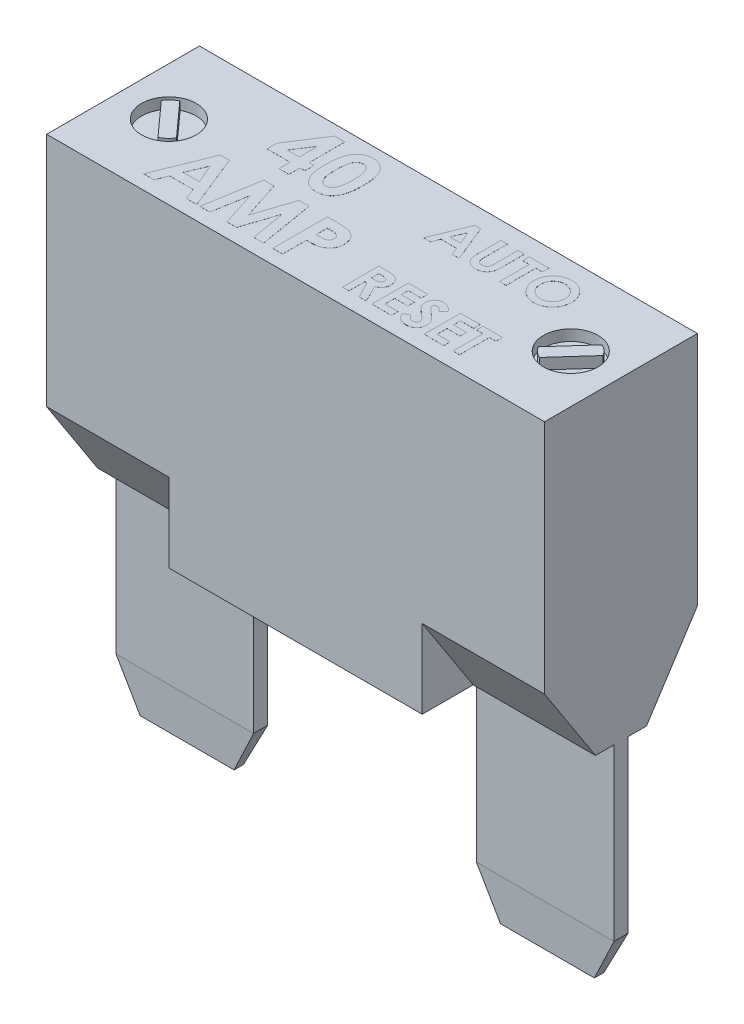
from build123d import *
from OCP.BRepFilletAPI import BRepFilletAPI_MakeChamfer

# Parameters (mm, degrees)
EXTRUDE1_DEPTH            = 14.478
SKETCH2_W                 = 8.89
SKETCH2_H                 = 18.288
EXTRUDE2_DEPTH            = 7.366
SKETCH3_W                 = 8.001
SKETCH3_H                 = 0.8128
EXTRUDE3_DEPTH            = 12.446
CHAMFER1_SIZE             = 2.54
CHAMFER1_SIZE2            = 0.133115759
CHAMFER2_SIZE             = 2.54
CHAMFER2_SIZE2            = 1.270274247
SKETCH4_R                 = 1.5875
EXTRUDE4_DEPTH            = 0.635
EXTRUDE5_DEPTH            = 0.635
CHAMFER1_OF_MIRROR1_SIZE  = 2.54
CHAMFER1_OF_MIRROR1_SIZE2 = 0.133115759
CHAMFER2_OF_MIRROR1_SIZE  = 2.54
CHAMFER2_OF_MIRROR1_SIZE2 = 1.270274247
EXTRUDE6_DEPTH            = 0.00254


with BuildPart() as part:
    # Sketch1 → Extrude1 (new, symmetric)
    with BuildSketch(Plane(origin=(0, 0, 0), x_dir=(0, 0, -1), z_dir=(1, 0, 0))):
        Polygon((-4.445, 4.572), (-1.481577724, 0), (1.481577724, 0), (4.445, 4.572), (4.445, 18.288), (-4.445, 18.288), align=None)
    extrude(amount=EXTRUDE1_DEPTH, both=True)

    # Sketch2 → Extrude2 (add, symmetric)
    with BuildSketch(Plane(origin=(0, 0, 0), x_dir=(0, 0, -1), z_dir=(1, 0, 0))):
        with Locations((0, 9.144)):
            Rectangle(SKETCH2_W, SKETCH2_H)
    extrude(amount=EXTRUDE2_DEPTH, both=True)

    # Sketch3 → Extrude3 (add)
    with BuildSketch(Plane.XZ):
        with Locations((-10.4775, 0)):
            Rectangle(SKETCH3_W, SKETCH3_H)
    extrude3 = extrude(amount=EXTRUDE3_DEPTH)

    # Chamfer1: one chamfer whose edges measure the first distance from different faces: ONE call of the kernel's chamfer builder (chamfer() names one face for all edges)
    chamfer1_edges_1 = [part.edges().sort_by_distance(p)[0] for p in [
        (-10.4775, -12.446, -0.4064),
    ]]
    chamfer1_side_1 = [part.faces().sort_by_distance(p)[0] for p in [
        (-10.4775, -6.223, -0.4064),
    ]]
    chamfer1_edges_2 = [part.edges().sort_by_distance(p)[0] for p in [
        (-10.4775, -12.446, 0.4064),
    ]]
    chamfer1_side_2 = [part.faces().sort_by_distance(p)[0] for p in [
        (-10.4775, -6.223, 0.4064),
    ]]
    chamfer1 = BRepFilletAPI_MakeChamfer(part.part.solid().wrapped)
    for e in chamfer1_edges_1:
        chamfer1.Add(CHAMFER1_SIZE, CHAMFER1_SIZE2, e.wrapped, chamfer1_side_1[0].wrapped)  # the first distance lies on this face
    for e in chamfer1_edges_2:
        chamfer1.Add(CHAMFER1_SIZE, CHAMFER1_SIZE2, e.wrapped, chamfer1_side_2[0].wrapped)  # the first distance lies on this face
    add(Compound.cast(chamfer1.Shape()), mode=Mode.REPLACE)

    # Chamfer2: one chamfer whose edges measure the first distance from different faces: ONE call of the kernel's chamfer builder (chamfer() names one face for all edges)
    chamfer2_edges_1 = [part.edges().sort_by_distance(p)[0] for p in [
        (-14.478, -12.446, 0),
    ]]
    chamfer2_side_1 = [part.faces().sort_by_distance(p)[0] for p in [
        (-14.478, 8.85938846, 0),
    ]]
    chamfer2_edges_2 = [part.edges().sort_by_distance(p)[0] for p in [
        (-6.477, -12.446, 0),
    ]]
    chamfer2_side_2 = [part.faces().sort_by_distance(p)[0] for p in [
        (-6.477, -6.037091359, 0),
    ]]
    chamfer2 = BRepFilletAPI_MakeChamfer(part.part.solid().wrapped)
    for e in chamfer2_edges_1:
        chamfer2.Add(CHAMFER2_SIZE, CHAMFER2_SIZE2, e.wrapped, chamfer2_side_1[0].wrapped)  # the first distance lies on this face
    for e in chamfer2_edges_2:
        chamfer2.Add(CHAMFER2_SIZE, CHAMFER2_SIZE2, e.wrapped, chamfer2_side_2[0].wrapped)  # the first distance lies on this face
    add(Compound.cast(chamfer2.Shape()), mode=Mode.REPLACE)

    # Sketch4 → Extrude4 (cut)
    with BuildSketch(Plane(origin=(0, 18.288, 0), x_dir=(1, 0, 0), z_dir=(0, 1, 0))):
        with Locations(Location((-11.684, -0.127, 0), (0, 0, 270))):
            Circle(SKETCH4_R)
        with Locations(Location((11.684, -0.127, 0), (0, 0, 90))):
            Circle(SKETCH4_R)
    extrude(amount=-EXTRUDE4_DEPTH, mode=Mode.SUBTRACT)

    # Sketch5 → Extrude5 (add)
    with BuildSketch(Plane(origin=(0, 17.653, 0), x_dir=(1, 0, 0), z_dir=(0, 1, 0))):
        with BuildLine():
            Line((-10.520386715, -0.849927911), (-12.281336928, 1.105805433))
            ThreePointArc((-12.281336928, 1.105805433), (-12.600640707, 0.89103264), (-12.847613285, 0.595927911))
            Line((-12.847613285, 0.595927911), (-11.086663072, -1.359805433))
            ThreePointArc((-11.086663072, -1.359805433), (-10.767359293, -1.14503264), (-10.520386715, -0.849927911))
        make_face()
    extrude5 = extrude(amount=EXTRUDE5_DEPTH)

    # Mirror1: Extrude3, Extrude5 across plane
    add(extrude3.mirror(Plane(origin=(0, 0, 0), x_dir=(0, 0, 1), z_dir=(1, 0, 0))))
    add(extrude5.mirror(Plane(origin=(0, 0, 0), x_dir=(0, 0, 1), z_dir=(1, 0, 0))))

    # Chamfer1 of Mirror1: one chamfer whose edges measure the first distance from different faces: ONE call of the kernel's chamfer builder (chamfer() names one face for all edges)
    chamfer1_of_mirror1_edges_1 = [part.edges().sort_by_distance(p)[0] for p in [
        (10.4775, -12.446, -0.4064),
    ]]
    chamfer1_of_mirror1_side_1 = [part.faces().sort_by_distance(p)[0] for p in [
        (10.4775, -6.223, -0.4064),
    ]]
    chamfer1_of_mirror1_edges_2 = [part.edges().sort_by_distance(p)[0] for p in [
        (10.4775, -12.446, 0.4064),
    ]]
    chamfer1_of_mirror1_side_2 = [part.faces().sort_by_distance(p)[0] for p in [
        (10.4775, -6.223, 0.4064),
    ]]
    chamfer1_of_mirror1 = BRepFilletAPI_MakeChamfer(part.part.solid().wrapped)
    for e in chamfer1_of_mirror1_edges_1:
        chamfer1_of_mirror1.Add(CHAMFER1_OF_MIRROR1_SIZE, CHAMFER1_OF_MIRROR1_SIZE2, e.wrapped, chamfer1_of_mirror1_side_1[0].wrapped)  # the first distance lies on this face
    for e in chamfer1_of_mirror1_edges_2:
        chamfer1_of_mirror1.Add(CHAMFER1_OF_MIRROR1_SIZE, CHAMFER1_OF_MIRROR1_SIZE2, e.wrapped, chamfer1_of_mirror1_side_2[0].wrapped)  # the first distance lies on this face
    add(Compound.cast(chamfer1_of_mirror1.Shape()), mode=Mode.REPLACE)

    # Chamfer2 of Mirror1: one chamfer whose edges measure the first distance from different faces: ONE call of the kernel's chamfer builder (chamfer() names one face for all edges)
    chamfer2_of_mirror1_edges_1 = [part.edges().sort_by_distance(p)[0] for p in [
        (14.478, -12.446, 0),
    ]]
    chamfer2_of_mirror1_side_1 = [part.faces().sort_by_distance(p)[0] for p in [
        (14.478, 8.85938846, 0),
    ]]
    chamfer2_of_mirror1_edges_2 = [part.edges().sort_by_distance(p)[0] for p in [
        (6.477, -12.446, 0),
    ]]
    chamfer2_of_mirror1_side_2 = [part.faces().sort_by_distance(p)[0] for p in [
        (6.477, -6.037091359, 0),
    ]]
    chamfer2_of_mirror1 = BRepFilletAPI_MakeChamfer(part.part.solid().wrapped)
    for e in chamfer2_of_mirror1_edges_1:
        chamfer2_of_mirror1.Add(CHAMFER2_OF_MIRROR1_SIZE, CHAMFER2_OF_MIRROR1_SIZE2, e.wrapped, chamfer2_of_mirror1_side_1[0].wrapped)  # the first distance lies on this face
    for e in chamfer2_of_mirror1_edges_2:
        chamfer2_of_mirror1.Add(CHAMFER2_OF_MIRROR1_SIZE, CHAMFER2_OF_MIRROR1_SIZE2, e.wrapped, chamfer2_of_mirror1_side_2[0].wrapped)  # the first distance lies on this face
    add(Compound.cast(chamfer2_of_mirror1.Shape()), mode=Mode.REPLACE)

    # Sketch7 → Extrude6 (add)
    # profile 1 of 14: a face of its own
    with BuildSketch(Plane(origin=(0, 18.288, 0), x_dir=(1, 0, 0), z_dir=(0, 1, 0))):
        Polygon((-6.008239342, 3.833529575), (-5.414198877, 3.833529575), (-5.414198877, 1.757568037), (-5.129262979, 1.757568037), (-5.129262979, 1.22840137), (-5.414198877, 1.22840137), (-5.414198877, 0.577119319), (-5.984070672, 0.577119319), (-5.984070672, 1.22840137), (-7.327339903, 1.22840137), (-7.327339903, 1.805269359), align=None)
        Polygon((-5.984070672, 1.757568037), (-5.984070672, 2.838161987), (-6.686870151, 1.757568037), align=None, mode=Mode.SUBTRACT)
    # profile 2 of 14: a face of its own
    with BuildSketch(Plane(origin=(0, 18.288, 0), x_dir=(1, 0, 0), z_dir=(0, 1, 0))):
        with BuildLine():
            add(Edge.make_bspline(
                [(-3.775181449, 3.833529575), (-3.747597289, 3.833120081), (-3.69335946, 3.832314905), (-3.613477348, 3.823594194), (-3.536528788, 3.810419633), (-3.462212747, 3.792045714), (-3.391064161, 3.767728487), (-3.322565195, 3.738621183), (-3.257531185, 3.703197064), (-3.19513274, 3.663183703), (-3.135393895, 3.617882905), (-3.079750432, 3.566237656), (-3.027186183, 3.509436316), (-2.97883897, 3.44662015), (-2.933638131, 3.378360538), (-2.891732186, 3.304646657), (-2.853441936, 3.225117725), (-2.81833824, 3.139630227), (-2.786948404, 3.046902742), (-2.760508784, 2.945871645), (-2.737832386, 2.836513865), (-2.718691906, 2.718557193), (-2.704224796, 2.591844837), (-2.694473673, 2.456460977), (-2.687781991, 2.312666615), (-2.687235863, 2.214024865), (-2.686955287, 2.163347284)],
                knots=[0, 0, 0, 0, 0.879237366, 1.728815576, 2.559023295, 3.367336655, 4.166867292, 4.954216142, 5.737608147, 6.525189134, 7.316157332, 8.124696809, 8.942788509, 9.781158001, 10.649253743, 11.551476218, 12.482711956, 13.461909668, 14.496590415, 15.601789533, 16.789733467, 18.056700938, 19.410929216, 20.8549011, 22.384193279, 24, 24, 24, 24], degree=3))
            add(Edge.make_bspline(
                [(-2.686955287, 2.163347284), (-2.687258514, 2.112035669), (-2.687847677, 2.012338123), (-2.694195498, 1.867228544), (-2.705126746, 1.730861717), (-2.719215727, 1.603251749), (-2.738513778, 1.484466028), (-2.761114477, 1.374196981), (-2.787971439, 1.272484576), (-2.820395246, 1.179557993), (-2.855286458, 1.09392036), (-2.893681448, 1.01454649), (-2.934910995, 0.941221396), (-2.978029419, 0.872838869), (-3.025400628, 0.811414789), (-3.074718935, 0.754860419), (-3.128131744, 0.705329986), (-3.183390172, 0.660270913), (-3.242518556, 0.621330833), (-3.304907123, 0.58727448), (-3.371668151, 0.559650733), (-3.4415847, 0.535625073), (-3.515848514, 0.518377242), (-3.593279548, 0.504691655), (-3.674751986, 0.49712816), (-3.730221702, 0.496189858), (-3.758644991, 0.495709062)],
                knots=[0, 0, 0, 0, 1.643780988, 3.193836972, 4.651895693, 6.025988579, 7.305620092, 8.505800249, 9.631074763, 10.672816429, 11.65661981, 12.592235626, 13.49536222, 14.350718032, 15.179365177, 15.97804903, 16.751647189, 17.51006938, 18.259804725, 19.016521909, 19.783502495, 20.571750527, 21.382245291, 22.22305063, 23.089471752, 24, 24, 24, 24], degree=3))
            add(Edge.make_bspline(
                [(-3.758644991, 0.495709062), (-3.787067512, 0.496199133), (-3.842746812, 0.497159173), (-3.924439559, 0.504635417), (-4.00228094, 0.518432682), (-4.077132299, 0.535757489), (-4.148472683, 0.559597574), (-4.216644168, 0.588047803), (-4.281122573, 0.621891661), (-4.34208643, 0.660922469), (-4.399327589, 0.705680062), (-4.453735579, 0.755685708), (-4.505190045, 0.810812655), (-4.552908238, 0.87167837), (-4.597671644, 0.937470424), (-4.639013451, 1.008940129), (-4.676908813, 1.085983428), (-4.712543106, 1.168707711), (-4.743504795, 1.258893936), (-4.771059261, 1.357347456), (-4.793631155, 1.464888961), (-4.811784982, 1.581483903), (-4.826278988, 1.70688527), (-4.837060862, 1.84115359), (-4.843443942, 1.984351402), (-4.844026927, 2.082778391), (-4.844327082, 2.133454455)],
                knots=[0, 0, 0, 0, 0.917216111, 1.796812873, 2.643793957, 3.46689424, 4.273913431, 5.068098542, 5.848489301, 6.620921603, 7.401012384, 8.190319798, 9.003608147, 9.831726257, 10.68377682, 11.569763213, 12.493818149, 13.453288342, 14.474581811, 15.568529029, 16.750744269, 18.018426408, 19.375425659, 20.823733699, 22.36466933, 24, 24, 24, 24], degree=3))
            add(Edge.make_bspline(
                [(-4.844327082, 2.133454455), (-4.843783379, 2.203864856), (-4.842734297, 2.339722633), (-4.829439555, 2.535997619), (-4.809926247, 2.717419844), (-4.781265819, 2.883685834), (-4.745827597, 3.035411388), (-4.700447108, 3.171597018), (-4.648784722, 3.294127158), (-4.604761733, 3.366714751), (-4.583559854, 3.401673606)],
                knots=[0, 0, 0, 0, 1.288568992, 2.486310467, 3.599230591, 4.627010532, 5.572937695, 6.447898582, 7.252493626, 8, 8, 8, 8], degree=3))
            add(Edge.make_bspline(
                [(-4.583559854, 3.401673606), (-4.55890732, 3.436017174), (-4.510706758, 3.503165617), (-4.426426728, 3.591318971), (-4.335878809, 3.666712036), (-4.237203198, 3.727638599), (-4.131960491, 3.775685292), (-4.019247126, 3.80962013), (-3.899479335, 3.829392148), (-3.817232794, 3.832129838), (-3.775181449, 3.833529575)],
                knots=[0, 0, 0, 0, 1.058512271, 2.069600068, 3.047294572, 4.004278952, 4.967380941, 5.939006123, 6.946246673, 8, 8, 8, 8], degree=3))
        make_face()
        with BuildLine():
            add(Edge.make_bspline(
                [(-3.761189061, 3.26365778), (-3.786125371, 3.262475849), (-3.835013774, 3.260158636), (-3.905953177, 3.240488766), (-3.972844605, 3.21010759), (-4.023727127, 3.173548596), (-4.061812189, 3.138502416), (-4.088422495, 3.106786763), (-4.114083941, 3.07139438), (-4.136749423, 3.03072819), (-4.158151554, 2.986249378), (-4.179067887, 2.937756038), (-4.196213788, 2.884057066), (-4.21305918, 2.826066965), (-4.227817317, 2.762182461), (-4.240181399, 2.691881369), (-4.25122762, 2.614706515), (-4.258932491, 2.530607349), (-4.266115743, 2.43967186), (-4.271265038, 2.341697479), (-4.273417829, 2.236710636), (-4.274102136, 2.164407756), (-4.274455287, 2.127094279)],
                knots=[0, 0, 0, 0, 1.076674018, 2.110852608, 3.161083442, 4.239746716, 4.804137807, 5.395870207, 6.026861976, 6.692161227, 7.405688833, 8.16177676, 8.973626916, 9.841385931, 10.773283133, 11.807421078, 12.927755683, 14.143907515, 15.458935494, 16.872852025, 18.386167141, 20, 20, 20, 20], degree=3))
            add(Edge.make_bspline(
                [(-4.274455287, 2.127094279), (-4.273874043, 2.078752865), (-4.272759464, 1.986054621), (-4.266921819, 1.852751318), (-4.255220744, 1.731434579), (-4.240666969, 1.621282194), (-4.220225599, 1.523008532), (-4.196706478, 1.435683833), (-4.167662456, 1.360421274), (-4.134096492, 1.296132389), (-4.096920675, 1.241441969), (-4.05656469, 1.194954865), (-4.014402514, 1.154699227), (-3.969118128, 1.122000068), (-3.920819567, 1.09694094), (-3.869910036, 1.078916218), (-3.816357182, 1.067882536), (-3.77968474, 1.066352519), (-3.761189061, 1.065580857)],
                knots=[0, 0, 0, 0, 1.771748488, 3.397459088, 4.888034009, 6.237357457, 7.467047327, 8.564189669, 9.548206622, 10.417051504, 11.216568818, 11.965764335, 12.669334354, 13.348544111, 14.005342236, 14.656555988, 15.322436492, 16, 16, 16, 16], degree=3))
            add(Edge.make_bspline(
                [(-3.761189061, 1.065580857), (-3.743328096, 1.066108885), (-3.708358546, 1.067142698), (-3.657365111, 1.077754651), (-3.609142095, 1.095007382), (-3.563835099, 1.11941258), (-3.521282066, 1.150447524), (-3.481690969, 1.188248594), (-3.445360397, 1.233192579), (-3.42419404, 1.266547663), (-3.413287419, 1.283734904)],
                knots=[0, 0, 0, 0, 0.992283464, 1.942767638, 2.88273346, 3.832339453, 4.79467288, 5.803907806, 6.868395428, 8, 8, 8, 8], degree=3))
            add(Edge.make_bspline(
                [(-3.413287419, 1.283734904), (-3.400446709, 1.307220719), (-3.373520782, 1.356468569), (-3.342362053, 1.439572479), (-3.316134371, 1.533299955), (-3.293560589, 1.637942685), (-3.278121499, 1.753913393), (-3.264825374, 1.880476699), (-3.258412322, 2.018269924), (-3.257369204, 2.113733567), (-3.256827082, 2.163347284)],
                knots=[0, 0, 0, 0, 0.710965849, 1.490837728, 2.352621235, 3.297892224, 4.334225155, 5.461620853, 6.680770821, 8, 8, 8, 8], degree=3))
            add(Edge.make_bspline(
                [(-3.256827082, 2.163347284), (-3.257036492, 2.213391671), (-3.257439571, 2.309718575), (-3.264834896, 2.448007176), (-3.275133451, 2.574310862), (-3.290197265, 2.688347648), (-3.309579599, 2.790394366), (-3.333468398, 2.880444345), (-3.361631516, 2.958675056), (-3.395029618, 3.025008491), (-3.43202009, 3.081382812), (-3.471286606, 3.129747606), (-3.5129952, 3.171040248), (-3.557076122, 3.205416127), (-3.604549639, 3.231681878), (-3.654508947, 3.25022767), (-3.707056465, 3.261447253), (-3.742901311, 3.262910992), (-3.761189061, 3.26365778)],
                knots=[0, 0, 0, 0, 1.793836731, 3.452829483, 4.963243077, 6.335886805, 7.574563692, 8.684454726, 9.672768357, 10.54971625, 11.340229787, 12.085688095, 12.778991901, 13.440269426, 14.083255152, 14.715733572, 15.344777694, 16, 16, 16, 16], degree=3))
        make_face(mode=Mode.SUBTRACT)
    # profile 3 of 14: a face of its own
    with BuildSketch(Plane(origin=(0, 18.288, 0), x_dir=(1, 0, 0), z_dir=(0, 1, 0))):
        Polygon((-8.381308192, -0.44156083), (-7.852777543, -0.44156083), (-6.570566004, -3.61656083), (-7.179234874, -3.61656083), (-7.426009714, -2.965278779), (-8.809348055, -2.965278779), (-9.056122895, -3.61656083), (-9.664155748, -3.61656083), align=None)
        Polygon((-8.117360876, -1.293188434), (-8.593102062, -2.395406984), (-7.64161969, -2.395406984), align=None, mode=Mode.SUBTRACT)
    # profile 4 of 14: a face of its own
    with BuildSketch(Plane(origin=(0, 18.288, 0), x_dir=(1, 0, 0), z_dir=(0, 1, 0))):
        Polygon((-5.851230067, -0.44156083), (-5.259733672, -0.44156083), (-4.535309594, -2.656174212), (-3.805797374, -0.44156083), (-3.220025139, -0.44156083), (-2.683226261, -3.61656083), (-3.260094249, -3.61656083), (-3.599091645, -1.611197248), (-4.259277943, -3.61656083), (-4.81515735, -3.61656083), (-5.471527543, -1.611197248), (-5.809888921, -3.61656083), (-6.387392927, -3.61656083), align=None)
    # profile 5 of 14: a face of its own
    with BuildSketch(Plane(origin=(0, 18.288, 0), x_dir=(1, 0, 0), z_dir=(0, 1, 0))):
        with BuildLine():
            Line((-2.154059594, -0.44156083), (-1.518041966, -0.44156083))
            add(Edge.make_bspline(
                [(-1.518041966, -0.44156083), (-1.476485399, -0.441746846), (-1.396314071, -0.44210571), (-1.28070042, -0.446457413), (-1.174041166, -0.454255929), (-1.076360814, -0.463893661), (-0.987699528, -0.477405387), (-0.907946277, -0.492895523), (-0.837084511, -0.511767016), (-0.774315157, -0.534167218), (-0.71798169, -0.56057618), (-0.664672061, -0.58870361), (-0.615591073, -0.622272705), (-0.568261461, -0.657665532), (-0.52538914, -0.698263153), (-0.484299479, -0.741363737), (-0.446732736, -0.788676619), (-0.412514841, -0.839629089), (-0.381473939, -0.893279762), (-0.354354529, -0.949724551), (-0.332356783, -1.009052774), (-0.313903409, -1.070880643), (-0.29908148, -1.135205465), (-0.289215531, -1.202422844), (-0.282514083, -1.27206344), (-0.281922773, -1.319460875), (-0.281623696, -1.343433827)],
                knots=[0, 0, 0, 0, 1.698747864, 3.27724071, 4.728299578, 6.070144658, 7.288476769, 8.393259625, 9.389771311, 10.283485332, 11.113357557, 11.931608583, 12.74405601, 13.541433047, 14.344816069, 15.154114104, 15.974336324, 16.810834471, 17.661136416, 18.50621059, 19.367396281, 20.244825668, 21.142564693, 22.063065223, 23.020325768, 24, 24, 24, 24], degree=3))
            add(Edge.make_bspline(
                [(-0.281623696, -1.343433827), (-0.282056423, -1.369954533), (-0.282906782, -1.42207098), (-0.29124305, -1.498467297), (-0.305484029, -1.571304269), (-0.324096243, -1.641196142), (-0.350049653, -1.706993041), (-0.379700204, -1.770264899), (-0.416179788, -1.829237769), (-0.457863543, -1.884649328), (-0.50338696, -1.936950101), (-0.553830762, -1.98463), (-0.608233468, -2.028014057), (-0.66628016, -2.067556943), (-0.728188764, -2.103178888), (-0.79391461, -2.135213456), (-0.863906509, -2.162636081), (-0.912646763, -2.176977892), (-0.937357871, -2.184249131)],
                knots=[0, 0, 0, 0, 1.102006807, 2.165578795, 3.188629044, 4.184801286, 5.166646146, 6.124351954, 7.085497154, 8.042432466, 9.003981491, 9.963833307, 10.922997304, 11.89326795, 12.880200226, 13.889073926, 14.929769137, 16, 16, 16, 16], degree=3))
            add(Edge.make_bspline(
                [(-0.937357871, -2.184249131), (-0.953634029, -2.188298666), (-0.988893427, -2.197071261), (-1.047238047, -2.205977647), (-1.114474096, -2.214166522), (-1.190818991, -2.221203868), (-1.276316748, -2.225987624), (-1.370884582, -2.229723524), (-1.47456535, -2.23243991), (-1.546660856, -2.232536299), (-1.584187799, -2.232586471)],
                knots=[0, 0, 0, 0, 0.618981996, 1.340914327, 2.176866532, 3.120127938, 4.170906482, 5.338178032, 6.614476169, 8, 8, 8, 8], degree=3))
            Line((-1.584187799, -2.232586471), (-1.584187799, -3.61656083))
            Line((-1.584187799, -3.61656083), (-2.154059594, -3.61656083))
            Line((-2.154059594, -3.61656083), (-2.154059594, -0.44156083))
        make_face()
        with BuildLine():
            Line((-1.584187799, -1.662714676), (-1.382570211, -1.662714676))
            add(Edge.make_bspline(
                [(-1.382570211, -1.662714676), (-1.345882708, -1.662482049), (-1.278377157, -1.662054012), (-1.186188412, -1.655864339), (-1.112103764, -1.646411459), (-1.053575516, -1.632853843), (-1.007361921, -1.612278366), (-0.967505588, -1.588476413), (-0.933319794, -1.558379497), (-0.903719928, -1.523988621), (-0.880055728, -1.484471781), (-0.863645837, -1.440472431), (-0.852986295, -1.392915046), (-0.852001787, -1.359818253), (-0.851495491, -1.342797809)],
                knots=[0, 0, 0, 0, 1.8619151, 3.425951444, 4.686033666, 5.651700536, 6.461346321, 7.243864085, 7.999046032, 8.762387399, 9.539336099, 10.322741239, 11.137448474, 12, 12, 12, 12], degree=3))
            add(Edge.make_bspline(
                [(-0.851495491, -1.342797809), (-0.851996579, -1.327927269), (-0.852968809, -1.299074846), (-0.860111079, -1.257433642), (-0.871493802, -1.21861545), (-0.88798693, -1.183025674), (-0.90930864, -1.150724787), (-0.935304119, -1.121725514), (-0.965639794, -1.09540681), (-0.989060708, -1.081475918), (-1.000959634, -1.07439837)],
                knots=[0, 0, 0, 0, 1.102301479, 2.1387299, 3.123554645, 4.094223062, 5.036071848, 5.982632524, 6.975082478, 8, 8, 8, 8], degree=3))
            add(Edge.make_bspline(
                [(-1.000959634, -1.07439837), (-1.011038711, -1.069301092), (-1.032378182, -1.058509109), (-1.068721371, -1.045962641), (-1.110660855, -1.035378312), (-1.158479775, -1.026593422), (-1.211987366, -1.019775434), (-1.271174082, -1.01456138), (-1.336127021, -1.012464605), (-1.381297904, -1.011786106), (-1.404830828, -1.011432625)],
                knots=[0, 0, 0, 0, 0.656809284, 1.390599849, 2.23162475, 3.173112763, 4.218524733, 5.370385145, 6.63003504, 8, 8, 8, 8], degree=3))
            Line((-1.404830828, -1.011432625), (-1.584187799, -1.011432625))
            Line((-1.584187799, -1.011432625), (-1.584187799, -1.662714676))
        make_face(mode=Mode.SUBTRACT)
    # profile 6 of 14: a face of its own
    with BuildSketch(Plane(origin=(0, 18.288, 0), x_dir=(1, 0, 0), z_dir=(0, 1, 0))):
        Polygon((2.557586423, 3.413395415), (2.909940189, 3.413395415), (3.764747882, 1.296728748), (3.358968635, 1.296728748), (3.194452075, 1.730916783), (2.272226514, 1.730916783), (2.107709954, 1.296728748), (1.702354719, 1.296728748), align=None)
        Polygon((2.733551301, 2.845643679), (2.41639051, 2.110831313), (3.050712091, 2.110831313), align=None, mode=Mode.SUBTRACT)
    # profile 7 of 14: a face of its own
    with BuildSketch(Plane(origin=(0, 18.288, 0), x_dir=(1, 0, 0), z_dir=(0, 1, 0))):
        with BuildLine():
            Line((4.076820531, 3.413395415), (4.456735061, 3.413395415))
            Line((4.456735061, 3.413395415), (4.456735061, 2.036205244))
            add(Edge.make_bspline(
                [(4.456735061, 2.036205244), (4.456755719, 2.021927134), (4.45679562, 1.994349111), (4.458793058, 1.954783678), (4.460620853, 1.91841476), (4.463918712, 1.885282175), (4.468790781, 1.855371749), (4.473508534, 1.828491349), (4.479893545, 1.805122236), (4.489489196, 1.778522068), (4.504272945, 1.748635327), (4.52842877, 1.717486679), (4.556302526, 1.689059017), (4.589710828, 1.665396908), (4.627258805, 1.646256395), (4.668740148, 1.632075393), (4.714096381, 1.624192639), (4.745457729, 1.622989192), (4.761599511, 1.622369774)],
                knots=[0, 0, 0, 0, 1.155499968, 2.231836252, 3.205919964, 4.102923608, 4.924856345, 5.658536265, 6.31071849, 6.882491295, 7.94666036, 8.992281882, 10.060072772, 11.158554251, 12.289267114, 13.461410017, 14.693379945, 16, 16, 16, 16], degree=3))
            add(Edge.make_bspline(
                [(4.761599511, 1.622369774), (4.778748162, 1.622870184), (4.812185129, 1.623845899), (4.860278883, 1.633423597), (4.904838018, 1.648674572), (4.944919066, 1.6704416), (4.980482141, 1.696533197), (5.010585538, 1.726285795), (5.034343028, 1.759758735), (5.049827277, 1.79064007), (5.05852092, 1.819063651), (5.065037238, 1.844459041), (5.069814421, 1.874423088), (5.074148437, 1.908487838), (5.076752848, 1.947006136), (5.079576906, 1.989668214), (5.080611949, 2.036765977), (5.080788365, 2.069561033), (5.08088036, 2.086662643)],
                knots=[0, 0, 0, 0, 1.261321664, 2.459363699, 3.594844139, 4.716940403, 5.803436589, 6.833651888, 7.818396249, 8.814403945, 9.360733334, 10.004355033, 10.743453831, 11.592799886, 12.532235708, 13.585170094, 14.740740724, 16, 16, 16, 16], degree=3))
            Line((5.08088036, 2.086662643), (5.08088036, 3.413395415))
            Line((5.08088036, 3.413395415), (5.46079489, 3.413395415))
            Line((5.46079489, 3.413395415), (5.46079489, 2.150688417))
            add(Edge.make_bspline(
                [(5.46079489, 2.150688417), (5.460742132, 2.125106034), (5.460640684, 2.075913605), (5.45908274, 2.005220624), (5.455766159, 1.940653925), (5.452980613, 1.882194643), (5.447589628, 1.829921531), (5.441973487, 1.783611369), (5.434815232, 1.743428269), (5.424164179, 1.697684693), (5.405783614, 1.64501264), (5.376151734, 1.584363055), (5.33853598, 1.524983437), (5.294076038, 1.467527004), (5.243876697, 1.414151829), (5.189050984, 1.367295334), (5.130469943, 1.327659792), (5.067521443, 1.296214339), (5.000259058, 1.271689257), (4.928017276, 1.255209637), (4.85084536, 1.244075799), (4.79754126, 1.243006257), (4.770079746, 1.242455244)],
                knots=[0, 0, 0, 0, 1.170808336, 2.251350247, 3.235597562, 4.129743112, 4.929140599, 5.639994148, 6.264258765, 6.79612947, 7.788252245, 8.809469599, 9.879094798, 10.999557536, 12.129761673, 13.226370002, 14.293821979, 15.358369427, 16.438775801, 17.562147481, 18.744053101, 20, 20, 20, 20], degree=3))
            add(Edge.make_bspline(
                [(4.770079746, 1.242455244), (4.75183377, 1.242762574), (4.715834834, 1.243368928), (4.662892083, 1.248715391), (4.611712514, 1.256594068), (4.562392293, 1.268088245), (4.51476024, 1.282936575), (4.468829008, 1.301213836), (4.424769289, 1.322818079), (4.382827636, 1.347550591), (4.34305566, 1.374294546), (4.306706128, 1.403941345), (4.272528165, 1.434298497), (4.24150916, 1.466643558), (4.213416132, 1.500636961), (4.188306938, 1.536355747), (4.166218882, 1.573796742), (4.146596353, 1.613634818), (4.129801382, 1.6578948), (4.115642591, 1.708151036), (4.103273138, 1.76519124), (4.09408089, 1.829143921), (4.085747145, 1.899798299), (4.080472343, 1.977338439), (4.077712857, 2.061766566), (4.077125489, 2.120298836), (4.076820531, 2.150688417)],
                knots=[0, 0, 0, 0, 1.001158378, 1.975264943, 2.917723546, 3.841610987, 4.75185031, 5.653588123, 6.552117133, 7.442167995, 8.324307438, 9.179605724, 10.014504199, 10.831958861, 11.636465792, 12.43274043, 13.225645099, 14.020104002, 14.867201867, 15.819789774, 16.883317127, 18.068162734, 19.364263498, 20.787406516, 22.332041935, 24, 24, 24, 24], degree=3))
            Line((4.076820531, 2.150688417), (4.076820531, 3.413395415))
        make_face()
    # profile 8 of 14: a face of its own
    with BuildSketch(Plane(origin=(0, 18.288, 0), x_dir=(1, 0, 0), z_dir=(0, 1, 0))):
        Polygon((5.732162412, 3.413395415), (6.871906001, 3.413395415), (6.871906001, 3.033480885), (6.491991472, 3.033480885), (6.491991472, 1.296728748), (6.112076942, 1.296728748), (6.112076942, 3.033480885), (5.732162412, 3.033480885), align=None)
    # profile 9 of 14: a face of its own
    with BuildSketch(Plane(origin=(0, 18.288, 0), x_dir=(1, 0, 0), z_dir=(0, 1, 0))):
        with BuildLine():
            add(Edge.make_bspline(
                [(8.165141845, 3.467668919), (8.20194269, 3.46671608), (8.274595891, 3.464834958), (8.381442533, 3.449154342), (8.484409028, 3.423605027), (8.583448815, 3.388089631), (8.67831391, 3.341646216), (8.769338935, 3.285591484), (8.856197841, 3.218867435), (8.938000568, 3.143030632), (9.013601042, 3.06056142), (9.079108896, 2.971768652), (9.134971591, 2.878953037), (9.181270743, 2.781865872), (9.216536164, 2.679834784), (9.241283369, 2.573379996), (9.257182222, 2.462531793), (9.259010834, 2.387059276), (9.259940189, 2.348701905)],
                knots=[0, 0, 0, 0, 1.014329547, 2.002516266, 2.970391464, 3.935626869, 4.897733899, 5.877609409, 6.878433252, 7.912639331, 8.949961323, 9.958554974, 10.949718813, 11.932905612, 12.9188844, 13.919928257, 14.942845884, 16, 16, 16, 16], degree=3))
            add(Edge.make_bspline(
                [(9.259940189, 2.348701905), (9.258950466, 2.310776734), (9.257000185, 2.236043967), (9.241932429, 2.126217274), (9.216768479, 2.020902838), (9.182101186, 1.919862279), (9.136641727, 1.823585), (9.081868415, 1.731456287), (9.016335888, 1.644331115), (8.942434373, 1.562256238), (8.86107522, 1.487755676), (8.77490296, 1.422102185), (8.684315485, 1.366469894), (8.589445386, 1.320884286), (8.490089218, 1.285506974), (8.386492403, 1.26054571), (8.278661352, 1.245376245), (8.205331008, 1.243438703), (8.168109928, 1.242455244)],
                knots=[0, 0, 0, 0, 1.051557043, 2.072126891, 3.067553643, 4.050577992, 5.02905126, 6.015227836, 7.017913613, 8.04756643, 9.074058332, 10.072836633, 11.047628519, 12.017157415, 12.98668631, 13.966869689, 14.968021931, 16, 16, 16, 16], degree=3))
            add(Edge.make_bspline(
                [(8.168109928, 1.242455244), (8.129181141, 1.243337456), (8.052691395, 1.245070881), (7.94074831, 1.26155496), (7.833497162, 1.286385742), (7.731838923, 1.323444352), (7.634738289, 1.369770731), (7.542908688, 1.426824444), (7.456380981, 1.494511205), (7.375651504, 1.571097532), (7.302510403, 1.654899771), (7.237949034, 1.743429406), (7.183490088, 1.836010147), (7.139131571, 1.932685324), (7.104161098, 2.032854125), (7.079493402, 2.137126606), (7.064921606, 2.245252684), (7.06289184, 2.318694078), (7.061863266, 2.355910105)],
                knots=[0, 0, 0, 0, 1.067978421, 2.098431617, 3.099715153, 4.085208694, 5.062210972, 6.048429807, 7.046490867, 8.072918869, 9.098532598, 10.095778865, 11.076610158, 12.041847152, 13.011192615, 13.984257998, 14.978533688, 16, 16, 16, 16], degree=3))
            add(Edge.make_bspline(
                [(7.061863266, 2.355910105), (7.062186092, 2.3809471), (7.062827655, 2.430704064), (7.070555962, 2.504441346), (7.081682501, 2.576739374), (7.098138124, 2.647309896), (7.1181275, 2.716650755), (7.144026561, 2.784116508), (7.173506701, 2.850427875), (7.207951469, 2.914801636), (7.246250721, 2.976645498), (7.288038614, 3.035667733), (7.333420225, 3.091154676), (7.382249363, 3.143470965), (7.4346943, 3.192272721), (7.490065178, 3.238250799), (7.549435869, 3.28018386), (7.611506935, 3.319095992), (7.675928434, 3.354283558), (7.742438112, 3.384234162), (7.809665737, 3.410389514), (7.87850938, 3.431032475), (7.94823126, 3.44784595), (8.019576213, 3.45896499), (8.091899679, 3.466693082), (8.14066985, 3.467342868), (8.165141845, 3.467668919)],
                knots=[0, 0, 0, 0, 1.034744296, 2.056386356, 3.06226378, 4.057406941, 5.050368692, 6.043467995, 7.042652155, 8.049140477, 9.059438543, 10.048523776, 11.036952808, 12.020949711, 13.004946614, 13.997082645, 14.994316842, 16.007702937, 17.024872941, 18.026463647, 19.021641123, 20.005082605, 20.995858141, 21.984425357, 22.988620895, 24, 24, 24, 24], degree=3))
        make_face()
        with BuildLine():
            add(Edge.make_bspline(
                [(8.159205681, 3.087754389), (8.134438718, 3.087089836), (8.085558643, 3.085778274), (8.013860476, 3.075785944), (7.945027703, 3.059827058), (7.879441892, 3.036710807), (7.816818788, 3.007289685), (7.757047381, 2.971666495), (7.70095538, 2.928616728), (7.647794852, 2.880451536), (7.599773063, 2.826784442), (7.557344298, 2.769271025), (7.521838255, 2.708007329), (7.492101722, 2.643562481), (7.469716703, 2.575211815), (7.453772526, 2.50349073), (7.4436964, 2.428275645), (7.442426292, 2.377001621), (7.441777796, 2.350821964)],
                knots=[0, 0, 0, 0, 1.033739768, 2.040188636, 3.016340934, 3.979330865, 4.937572243, 5.900995986, 6.878200029, 7.884839167, 8.891893314, 9.879764717, 10.863503415, 11.843163062, 12.837761627, 13.859916423, 14.907309254, 16, 16, 16, 16], degree=3))
            add(Edge.make_bspline(
                [(7.441777796, 2.350821964), (7.442637603, 2.321809016), (7.444322681, 2.264948445), (7.456179097, 2.182001775), (7.476464245, 2.103666878), (7.505755603, 2.030326878), (7.542084573, 1.961167389), (7.587199387, 1.89703606), (7.6403694, 1.8375489), (7.681331147, 1.802817819), (7.702121012, 1.785190287)],
                knots=[0, 0, 0, 0, 1.078454662, 2.113592447, 3.107694534, 4.079536787, 5.043276885, 6.005368276, 6.987637804, 8, 8, 8, 8], degree=3))
            add(Edge.make_bspline(
                [(7.702121012, 1.785190287), (7.719151881, 1.772167744), (7.752829909, 1.746416057), (7.806587375, 1.713409988), (7.861946979, 1.685120494), (7.91932648, 1.662262917), (7.978604694, 1.644283532), (8.039773494, 1.631692864), (8.102746207, 1.623791131), (8.145331307, 1.622846724), (8.166837892, 1.622369774)],
                knots=[0, 0, 0, 0, 1.023928204, 2.024787132, 3.009472467, 3.9914905, 4.972207045, 5.96565515, 6.972602802, 8, 8, 8, 8], degree=3))
            add(Edge.make_bspline(
                [(8.166837892, 1.622369774), (8.191178987, 1.623039962), (8.239070856, 1.624358578), (8.309434324, 1.634227896), (8.376844663, 1.650930347), (8.441720362, 1.673843814), (8.50387435, 1.703634344), (8.563002862, 1.740362453), (8.619209567, 1.78357717), (8.672302368, 1.832374877), (8.720831699, 1.886253382), (8.763171924, 1.94407357), (8.799806881, 2.004561491), (8.828925043, 2.068573257), (8.852194443, 2.13550463), (8.867946725, 2.205652032), (8.87810797, 2.27872629), (8.879378436, 2.328455906), (8.88002566, 2.353790047)],
                knots=[0, 0, 0, 0, 1.026359118, 2.019393844, 2.989460624, 3.950973911, 4.916101784, 5.890408035, 6.881132271, 7.902007068, 8.92769091, 9.933912415, 10.920395702, 11.90457117, 12.894218921, 13.903490204, 14.931958862, 16, 16, 16, 16], degree=3))
            add(Edge.make_bspline(
                [(8.88002566, 2.353790047), (8.879356042, 2.378978509), (8.878038003, 2.428558157), (8.868151314, 2.501444541), (8.851554786, 2.571282264), (8.828572511, 2.638185375), (8.799225364, 2.702219467), (8.762934639, 2.763159356), (8.719827676, 2.820946129), (8.670896579, 2.875185992), (8.617638087, 2.925028951), (8.560459775, 2.968283579), (8.500961556, 3.005870475), (8.437778249, 3.035314532), (8.372202534, 3.05877255), (8.303834263, 3.076047371), (8.232414487, 3.085708077), (8.183826137, 3.087066205), (8.159205681, 3.087754389)],
                knots=[0, 0, 0, 0, 1.055025985, 2.07665775, 3.074803781, 4.057872707, 5.035505728, 6.020516407, 7.023567878, 8.050795229, 9.077271434, 10.074415901, 11.050397877, 12.019801805, 12.988065821, 13.964604439, 14.968634123, 16, 16, 16, 16], degree=3))
        make_face(mode=Mode.SUBTRACT)
    # profile 10 of 14: a face of its own
    with BuildSketch(Plane(origin=(0, 18.288, 0), x_dir=(1, 0, 0), z_dir=(0, 1, 0))):
        with BuildLine():
            Line((1.82253207, -1.424321113), (2.26520034, -1.424321113))
            add(Edge.make_bspline(
                [(2.26520034, -1.424321113), (2.294460577, -1.42442497), (2.350736257, -1.424624717), (2.431882713, -1.427776185), (2.506426893, -1.432161712), (2.574479165, -1.438854143), (2.636010416, -1.447727497), (2.691082314, -1.458187714), (2.73969325, -1.470109373), (2.782253191, -1.484964701), (2.820661432, -1.501721285), (2.856463253, -1.520974908), (2.890448494, -1.542511175), (2.922390002, -1.566896761), (2.952565355, -1.593692978), (2.981031481, -1.622926798), (3.007386127, -1.654846111), (3.031466104, -1.689249229), (3.053413065, -1.72544052), (3.072809576, -1.763469675), (3.08858285, -1.803363141), (3.102520229, -1.84454437), (3.112558872, -1.887602058), (3.119540601, -1.932117029), (3.12465235, -1.978245982), (3.124946251, -2.009583945), (3.125096173, -2.025569778)],
                knots=[0, 0, 0, 0, 1.749336639, 3.364467119, 4.854658419, 6.213483162, 7.451590619, 8.570285859, 9.5643256, 10.440900261, 11.26203566, 12.067320669, 12.869050712, 13.665104639, 14.467235401, 15.27997916, 16.102287765, 16.939272006, 17.78853747, 18.631303466, 19.488103222, 20.351255419, 21.228522269, 22.127379805, 23.044756219, 24, 24, 24, 24], degree=3))
            add(Edge.make_bspline(
                [(3.125096173, -2.025569778), (3.124706729, -2.042255315), (3.123943101, -2.074972613), (3.119829783, -2.123031654), (3.112311931, -2.169011184), (3.10092505, -2.212776579), (3.08783731, -2.254872551), (3.070433972, -2.294522402), (3.050792586, -2.332302783), (3.027465085, -2.367679276), (3.001864292, -2.401437663), (2.972091108, -2.432284535), (2.940074379, -2.461877794), (2.904014327, -2.48836382), (2.865500513, -2.513533502), (2.823767708, -2.536343936), (2.779088275, -2.557368526), (2.747676421, -2.569093289), (2.731613267, -2.575089008)],
                knots=[0, 0, 0, 0, 1.099860209, 2.156625411, 3.176576793, 4.16617041, 5.135385252, 6.078461593, 7.016046972, 7.938469504, 8.868247731, 9.803980173, 10.76021508, 11.73834243, 12.748633912, 13.790971185, 14.870363756, 16, 16, 16, 16], degree=3))
            Line((2.731613267, -2.575089008), (3.220074805, -3.54098778))
            Line((3.220074805, -3.54098778), (2.7977591, -3.54098778))
            Line((2.7977591, -3.54098778), (2.331346173, -2.618338207))
            Line((2.331346173, -2.618338207), (2.2024466, -2.618338207))
            Line((2.2024466, -2.618338207), (2.2024466, -3.54098778))
            Line((2.2024466, -3.54098778), (1.82253207, -3.54098778))
            Line((1.82253207, -3.54098778), (1.82253207, -1.424321113))
        make_face()
        with BuildLine():
            Line((2.2024466, -2.238423677), (2.350426702, -2.238423677))
            add(Edge.make_bspline(
                [(2.350426702, -2.238423677), (2.368518499, -2.238219915), (2.403160404, -2.237829755), (2.452980013, -2.236020029), (2.498228099, -2.231659484), (2.539098973, -2.226150099), (2.575798294, -2.219788718), (2.607998716, -2.210672473), (2.636196399, -2.200904185), (2.660057198, -2.188764738), (2.680443318, -2.174959553), (2.698045427, -2.15927652), (2.712604895, -2.141125407), (2.72458808, -2.120999481), (2.733909695, -2.098720735), (2.740713759, -2.074533739), (2.744516225, -2.048162971), (2.744953712, -2.02996355), (2.745181643, -2.020481637)],
                knots=[0, 0, 0, 0, 1.688639943, 3.233382647, 4.650958383, 5.928841754, 7.082724185, 8.122798841, 9.049171256, 9.863274652, 10.613301712, 11.341792392, 12.054588806, 12.776240173, 13.521029143, 14.301969904, 15.115324896, 16, 16, 16, 16], degree=3))
            add(Edge.make_bspline(
                [(2.745181643, -2.020481637), (2.744750719, -2.009263841), (2.743904248, -1.98722856), (2.735504627, -1.955505482), (2.722134244, -1.926143602), (2.703807111, -1.899275586), (2.680726471, -1.875721228), (2.654239615, -1.854957875), (2.623774893, -1.838539768), (2.595566852, -1.827710559), (2.569904129, -1.821231332), (2.546744331, -1.81640307), (2.519925146, -1.812981141), (2.489426326, -1.809351577), (2.455325614, -1.806997989), (2.417437141, -1.805280338), (2.375869722, -1.804577563), (2.346893283, -1.804352898), (2.331770185, -1.804235643)],
                knots=[0, 0, 0, 0, 1.020303359, 2.004196876, 2.966617323, 3.9489082, 4.950758222, 5.960522915, 7.003732012, 8.091992268, 8.70421221, 9.413913587, 10.24622431, 11.166358409, 12.212345909, 13.359657661, 14.621978493, 16, 16, 16, 16], degree=3))
            Line((2.331770185, -1.804235643), (2.2024466, -1.804235643))
            Line((2.2024466, -1.804235643), (2.2024466, -2.238423677))
        make_face(mode=Mode.SUBTRACT)
    # profile 11 of 14: a face of its own
    with BuildSketch(Plane(origin=(0, 18.288, 0), x_dir=(1, 0, 0), z_dir=(0, 1, 0))):
        Polygon((3.532147455, -1.424321113), (4.671891045, -1.424321113), (4.671891045, -1.804235643), (3.912061985, -1.804235643), (3.912061985, -2.211286925), (4.671891045, -2.211286925), (4.671891045, -2.591201455), (3.912061985, -2.591201455), (3.912061985, -3.16107325), (4.671891045, -3.16107325), (4.671891045, -3.54098778), (3.532147455, -3.54098778), align=None)
    # profile 12 of 14: a face of its own
    with BuildSketch(Plane(origin=(0, 18.288, 0), x_dir=(1, 0, 0), z_dir=(0, 1, 0))):
        with BuildLine():
            Line((6.13727566, -1.707136952), (5.853187786, -1.967056156))
            add(Edge.make_bspline(
                [(5.853187786, -1.967056156), (5.84101868, -1.949890366), (5.817655693, -1.916934444), (5.779786727, -1.872805687), (5.74208876, -1.835160574), (5.704212541, -1.804156367), (5.665822351, -1.779981442), (5.626984829, -1.762865327), (5.587920157, -1.751984451), (5.561674728, -1.75062952), (5.548747348, -1.749962139)],
                knots=[0, 0, 0, 0, 1.299362458, 2.494594718, 3.587462134, 4.587049575, 5.512617175, 6.380583204, 7.202344345, 8, 8, 8, 8], degree=3))
            add(Edge.make_bspline(
                [(5.548747348, -1.749962139), (5.536689059, -1.750385022), (5.513407672, -1.751201499), (5.480218327, -1.759317215), (5.450752354, -1.77332375), (5.42503851, -1.791638473), (5.404669352, -1.813703468), (5.388406159, -1.836843975), (5.379248615, -1.862385861), (5.378043302, -1.879929058), (5.3774466, -1.888613982)],
                knots=[0, 0, 0, 0, 1.185010067, 2.2879431, 3.333075148, 4.379039566, 5.372662701, 6.27520591, 7.14612461, 8, 8, 8, 8], degree=3))
            add(Edge.make_bspline(
                [(5.3774466, -1.888613982), (5.377820523, -1.897424146), (5.378573551, -1.915166591), (5.385846777, -1.941170355), (5.396809605, -1.96657906), (5.407285035, -1.982046547), (5.412639576, -1.98995279)],
                knots=[0, 0, 0, 0, 0.967525499, 1.948461899, 2.951351359, 4, 4, 4, 4], degree=3))
            add(Edge.make_bspline(
                [(5.412639576, -1.98995279), (5.417507433, -1.996098231), (5.428712597, -2.010244223), (5.45007855, -2.032649269), (5.476909701, -2.060097412), (5.510238567, -2.09164479), (5.548681576, -2.12842597), (5.594020611, -2.168995071), (5.644950618, -2.21460847), (5.681150487, -2.246371989), (5.700119544, -2.263016359)],
                knots=[0, 0, 0, 0, 0.473873513, 1.090794244, 1.870441696, 2.795289791, 3.865433203, 5.087734844, 6.473946851, 8, 8, 8, 8], degree=3))
            add(Edge.make_bspline(
                [(5.700119544, -2.263016359), (5.717924732, -2.278425851), (5.751715281, -2.307669867), (5.799792522, -2.349177052), (5.842044409, -2.386520054), (5.879086457, -2.419138435), (5.910357144, -2.447374436), (5.935987932, -2.471363025), (5.956291857, -2.490637188), (5.96783345, -2.502278794), (5.9727591, -2.507247128)],
                knots=[0, 0, 0, 0, 1.543621617, 2.929473131, 4.163658386, 5.240097082, 6.164993805, 6.925417477, 7.541396219, 8, 8, 8, 8], degree=3))
            add(Edge.make_bspline(
                [(5.9727591, -2.507247128), (5.991445992, -2.527470347), (6.02736876, -2.566346476), (6.074055695, -2.626592249), (6.112480553, -2.685404408), (6.142206751, -2.743889598), (6.164657172, -2.802891646), (6.180485016, -2.863857573), (6.189964417, -2.927424434), (6.191016852, -2.970801057), (6.191549164, -2.992740584)],
                knots=[0, 0, 0, 0, 1.206664779, 2.319633467, 3.337109185, 4.282041471, 5.190008762, 6.099243693, 7.03861361, 8, 8, 8, 8], degree=3))
            add(Edge.make_bspline(
                [(6.191549164, -2.992740584), (6.191170278, -3.014117963), (6.190426889, -3.056061176), (6.181321794, -3.117438819), (6.168338464, -3.176179889), (6.148263958, -3.231645197), (6.12379727, -3.284745191), (6.093124741, -3.334652741), (6.057104063, -3.381872932), (6.015818835, -3.425561646), (5.97015247, -3.465206125), (5.921170954, -3.500498577), (5.86839532, -3.529636992), (5.812276475, -3.553630398), (5.752844459, -3.57211044), (5.690170073, -3.585768913), (5.624157452, -3.593966514), (5.57901707, -3.594823476), (5.555955548, -3.595261284)],
                knots=[0, 0, 0, 0, 1.043214005, 2.046824704, 3.02475056, 3.976699089, 4.921714032, 5.875962561, 6.831408892, 7.817874052, 8.806269674, 9.781291748, 10.760897367, 11.74438705, 12.757449933, 13.795994037, 14.874007457, 16, 16, 16, 16], degree=3))
            add(Edge.make_bspline(
                [(5.555955548, -3.595261284), (5.537852449, -3.594940123), (5.501997932, -3.59430404), (5.449153793, -3.589110952), (5.398126804, -3.580729859), (5.348974441, -3.56871725), (5.301475264, -3.553495646), (5.255627323, -3.534903039), (5.211747121, -3.512651251), (5.16950264, -3.487197867), (5.12909924, -3.457643136), (5.090026036, -3.424591295), (5.05267114, -3.38753399), (5.016855145, -3.346558862), (4.98280721, -3.301549878), (4.949412825, -3.253133872), (4.918156137, -3.200412309), (4.89884749, -3.163427706), (4.888985062, -3.144536792)],
                knots=[0, 0, 0, 0, 1.016823716, 2.013894106, 2.979844003, 3.91962641, 4.853723003, 5.779685073, 6.695824784, 7.614987388, 8.547259901, 9.504950863, 10.487499108, 11.500346958, 12.559593716, 13.656357062, 14.802919212, 16, 16, 16, 16], degree=3))
            Line((4.888985062, -3.144536792), (5.223106322, -2.943979233))
            add(Edge.make_bspline(
                [(5.223106322, -2.943979233), (5.235442746, -2.965422889), (5.259092724, -3.00653221), (5.299169824, -3.061767793), (5.340226766, -3.109067927), (5.383212751, -3.147596579), (5.427605085, -3.177868926), (5.473618193, -3.199503645), (5.521284404, -3.212895512), (5.553752461, -3.214530968), (5.569947936, -3.215346754)],
                knots=[0, 0, 0, 0, 1.283663364, 2.460892379, 3.537111102, 4.529833553, 5.449777664, 6.316464042, 7.160231139, 8, 8, 8, 8], degree=3))
            add(Edge.make_bspline(
                [(5.569947936, -3.215346754), (5.586421052, -3.214680539), (5.618381296, -3.213387985), (5.664000456, -3.201449049), (5.705825828, -3.182704044), (5.741979371, -3.155957507), (5.772591912, -3.125087938), (5.795185724, -3.090744131), (5.809379309, -3.053584961), (5.810879916, -3.027771758), (5.811634634, -3.014789195)],
                knots=[0, 0, 0, 0, 1.13588714, 2.203786484, 3.234766741, 4.283437687, 5.291419208, 6.222934724, 7.106237994, 8, 8, 8, 8], degree=3))
            add(Edge.make_bspline(
                [(5.811634634, -3.014789195), (5.810937682, -3.002711034), (5.809521891, -2.978175405), (5.799093609, -2.94169487), (5.782791024, -2.905230925), (5.763503916, -2.875322212), (5.743876868, -2.850280456), (5.725108983, -2.828582908), (5.702254665, -2.804610916), (5.675371861, -2.778334325), (5.644815763, -2.749521815), (5.610560631, -2.718176209), (5.57221421, -2.684573623), (5.545110883, -2.661683873), (5.530938855, -2.649715077)],
                knots=[0, 0, 0, 0, 0.916159276, 1.861089862, 2.860218735, 3.940849679, 4.552606315, 5.27541173, 6.11797699, 7.06649574, 8.129236253, 9.306560635, 10.591630461, 12, 12, 12, 12], degree=3))
            add(Edge.make_bspline(
                [(5.530938855, -2.649715077), (5.503997264, -2.626919908), (5.452288198, -2.583169079), (5.379216726, -2.518550482), (5.313372788, -2.458158483), (5.255325081, -2.401246503), (5.204333989, -2.348865576), (5.160744845, -2.300590243), (5.125036496, -2.256048127), (5.087461158, -2.20329097), (5.051757074, -2.13900275), (5.020898614, -2.061656569), (5.000878947, -1.984320202), (4.998636022, -1.932400824), (4.99753207, -1.906846487)],
                knots=[0, 0, 0, 0, 1.345494975, 2.582412109, 3.71882943, 4.751509156, 5.681369928, 6.505683931, 7.230279997, 7.856715994, 8.973648664, 10.023341002, 11.027102913, 12, 12, 12, 12], degree=3))
            add(Edge.make_bspline(
                [(4.99753207, -1.906846487), (4.997991202, -1.888724723), (4.998895741, -1.8530229), (5.00696437, -1.800528572), (5.019023244, -1.749875956), (5.03653619, -1.701249856), (5.059265879, -1.654711178), (5.086870204, -1.610032096), (5.119777807, -1.567623826), (5.156862454, -1.527514481), (5.197720241, -1.490859105), (5.241381978, -1.458507062), (5.287600536, -1.431182057), (5.336093174, -1.408513981), (5.387160381, -1.391163008), (5.440425945, -1.378863774), (5.495966269, -1.371548582), (5.533743598, -1.370554167), (5.552987466, -1.370047609)],
                knots=[0, 0, 0, 0, 1.010766082, 1.991317756, 2.957454644, 3.913069143, 4.869106762, 5.843196583, 6.838735724, 7.860187025, 8.887984031, 9.89767229, 10.887916223, 11.879572884, 12.879850636, 13.892031539, 14.926195476, 16, 16, 16, 16], degree=3))
            add(Edge.make_bspline(
                [(5.552987466, -1.370047609), (5.577926566, -1.370959934), (5.627607906, -1.372777384), (5.701063201, -1.386989243), (5.772811262, -1.409338889), (5.830627194, -1.436301278), (5.876630251, -1.462419757), (5.911887298, -1.486466362), (5.947763241, -1.514013041), (5.984547396, -1.545146601), (6.021556259, -1.580453637), (6.059842167, -1.61909364), (6.098883429, -1.661400548), (6.124254059, -1.691624407), (6.13727566, -1.707136952)],
                knots=[0, 0, 0, 0, 1.282922637, 2.555718331, 3.837320111, 5.142675274, 5.830281639, 6.55870424, 7.337177975, 8.157850921, 9.037902056, 9.96903443, 10.957596896, 12, 12, 12, 12], degree=3))
        make_face()
    # profile 13 of 14: a face of its own
    with BuildSketch(Plane(origin=(0, 18.288, 0), x_dir=(1, 0, 0), z_dir=(0, 1, 0))):
        Polygon((6.571463694, -1.424321113), (7.711207284, -1.424321113), (7.711207284, -1.804235643), (6.951378224, -1.804235643), (6.951378224, -2.211286925), (7.711207284, -2.211286925), (7.711207284, -2.591201455), (6.951378224, -2.591201455), (6.951378224, -3.16107325), (7.711207284, -3.16107325), (7.711207284, -3.54098778), (6.571463694, -3.54098778), align=None)
    # profile 14 of 14: a face of its own
    with BuildSketch(Plane(origin=(0, 18.288, 0), x_dir=(1, 0, 0), z_dir=(0, 1, 0))):
        Polygon((7.874027797, -1.424321113), (9.013771387, -1.424321113), (9.013771387, -1.804235643), (8.633856857, -1.804235643), (8.633856857, -3.54098778), (8.253942327, -3.54098778), (8.253942327, -1.804235643), (7.874027797, -1.804235643), align=None)
    extrude(amount=EXTRUDE6_DEPTH)


solid = part.part
